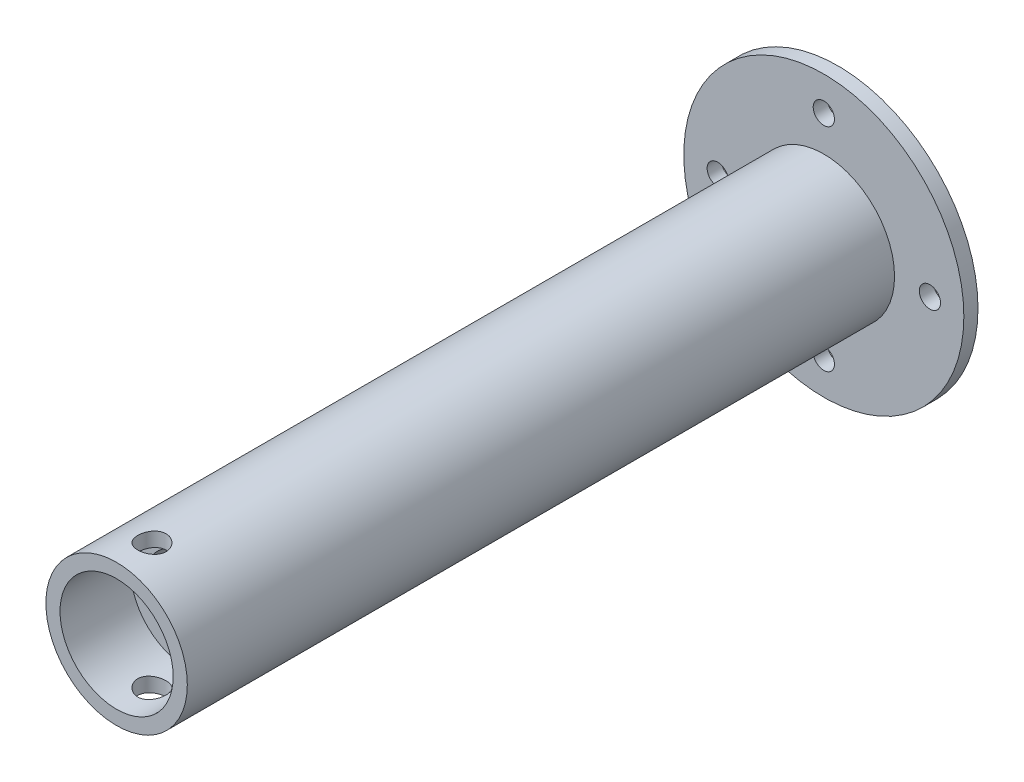
from build123d import *

# Parameters (mm, degrees)
SKETCH1_R           = 19.8
BOSS_EXTRUDE1_DEPTH = 2
SKETCH2_R           = 1.5
CUT_EXTRUDE1_DEPTH  = 5
SKETCH3_R           = 10
BOSS_EXTRUDE2_DEPTH = 100
SKETCH4_R           = 6
CUT_EXTRUDE3_DEPTH  = 200
SKETCH6_R           = 8
CUT_EXTRUDE4_DEPTH  = 10
SKETCH13_R          = 2
CUT_EXTRUDE7_DEPTH  = 20


with BuildPart() as part:
    # Sketch1 → Boss-Extrude1 (new body)
    with BuildSketch(Plane.XY):
        Circle(SKETCH1_R)
    extrude(amount=BOSS_EXTRUDE1_DEPTH)

    # Sketch2 → Cut-Extrude1 (cut)
    with BuildSketch(Plane.XY.offset(2)):
        with Locations((0, 15)):
            Circle(SKETCH2_R)
        with Locations((15, 0)):
            Circle(SKETCH2_R)
        with Locations((0, -15)):
            Circle(SKETCH2_R)
        with Locations((-15, 0)):
            Circle(SKETCH2_R)
    extrude(amount=-CUT_EXTRUDE1_DEPTH, mode=Mode.SUBTRACT)

    # Sketch3 → Boss-Extrude2 (add)
    with BuildSketch(Plane.XY.offset(2)):
        Circle(SKETCH3_R)
    extrude(amount=BOSS_EXTRUDE2_DEPTH)

    # Sketch4 → Cut-Extrude3 (cut)
    with BuildSketch(Plane.XY.offset(102)):
        Circle(SKETCH4_R)
    extrude(amount=-CUT_EXTRUDE3_DEPTH, mode=Mode.SUBTRACT)

    # Sketch6 → Cut-Extrude4 (cut)
    with BuildSketch(Plane.XY.offset(102)):
        Circle(SKETCH6_R)
    extrude(amount=-CUT_EXTRUDE4_DEPTH, mode=Mode.SUBTRACT)

    # Sketch13 → Cut-Extrude7 (cut)
    with BuildSketch(Plane(origin=(0, 10, 0), x_dir=(1, 0, 0), z_dir=(0, 1, 0))):
        with Locations(Location((0, -97, 0), (0, 0, 270))):
            Circle(SKETCH13_R)
    extrude(amount=-CUT_EXTRUDE7_DEPTH, mode=Mode.SUBTRACT)


solid = part.part
